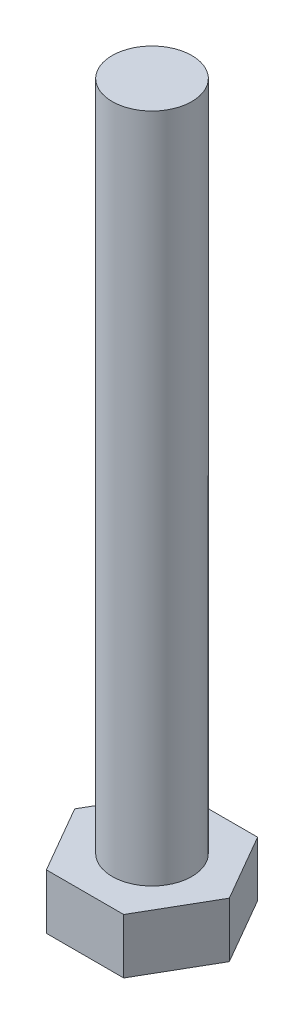
from build123d import *

# Parameters (mm, degrees)
SKETCH1_R           = 5
BOSS_EXTRUDE1_DEPTH = 6.9
SKETCH1_2_R         = 5
BOSS_EXTRUDE2_DEPTH = 91.1


with BuildPart() as part:
    # Sketch1 → Boss-Extrude1 (new body)
    with BuildSketch(Plane(origin=(0, 0, 0), x_dir=(1, 0, 0), z_dir=(0, 1, 0))):
        Polygon((4.849742261, -8.4), (9.699484522, 0), (4.849742261, 8.4), (-4.849742261, 8.4), (-9.699484522, 0), (-4.849742261, -8.4), align=None)
        Circle(SKETCH1_R, mode=Mode.SUBTRACT)
    extrude(amount=BOSS_EXTRUDE1_DEPTH)

    # Sketch1<2> → Boss-Extrude2 (add)
    with BuildSketch(Plane(origin=(0, 0, 0), x_dir=(1, 0, 0), z_dir=(0, 1, 0))):
        Circle(SKETCH1_2_R)
    extrude(amount=BOSS_EXTRUDE2_DEPTH)


solid = part.part
